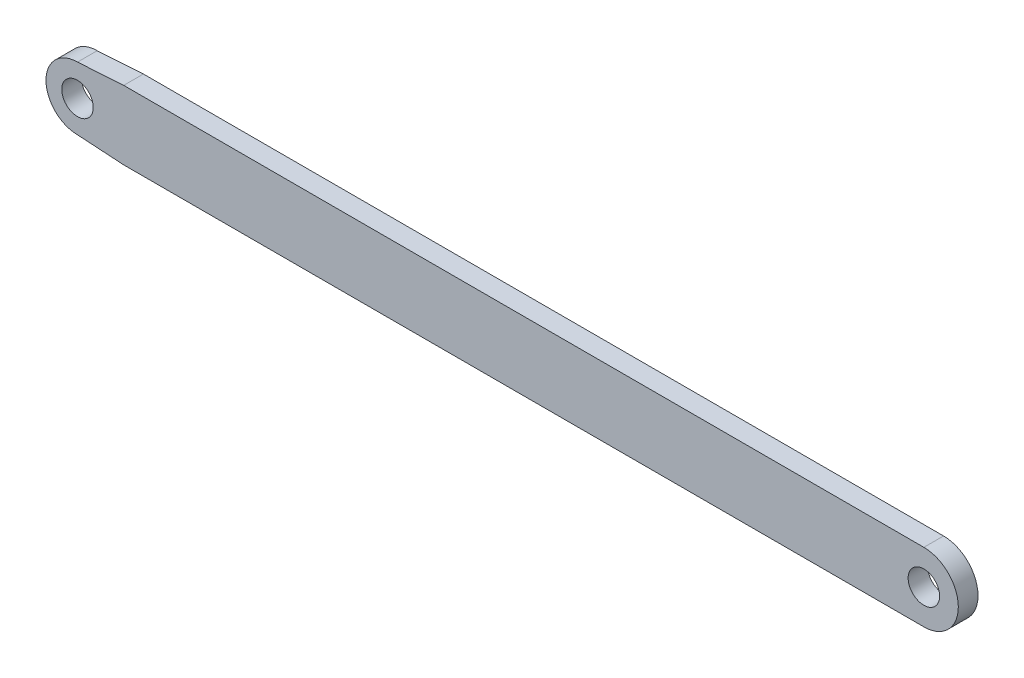
from build123d import *

# Parameters (mm, degrees)
SKETCH_3_R          = 8
EXTRUDE_1_DEPTH     = 5
SKETCH_4_R          = 4
CUT_EXTRUDE_1_DEPTH = 213.248558243


with BuildPart() as part:
    # 草图3 → 凸台-拉伸1 (new body)
    with BuildSketch(Plane.XY):
        with BuildLine():
            ThreePointArc((203.259167971, -8.750002099), (194.509167971, -2.099e-06), (203.259167971, 8.749997901))
            Line((203.259167971, 8.749997901), (0, 8.749997901))
            Line((0, 8.749997901), (-11.740832029, 8))
            ThreePointArc((-11.740832029, 8), (-6.08397778, 5.656854249), (-3.740832029, 0))
            ThreePointArc((-3.740832029, 0), (-6.08397778, -5.656854249), (-11.740832029, -8))
            Line((-11.740832029, -8), (0, -8.750038444))
            Line((0, -8.750038444), (203.259167971, -8.750002099))
        make_face()
        with Locations((-11.740832029, 0)):
            Circle(SKETCH_3_R)
        with BuildLine():
            ThreePointArc((212.009167971, -2.099e-06), (209.446352306, 6.187182236), (203.259167971, 8.749997901))
            Line((203.259167971, 8.749997901), (203.259167971, -8.750002099))
            ThreePointArc((203.259167971, -8.750002099), (209.446352306, -6.187186435), (212.009167971, -2.099e-06))
        make_face()
        with BuildLine():
            Line((203.259167971, -8.750002099), (203.259167971, 8.749997901))
            ThreePointArc((203.259167971, 8.749997901), (194.509167971, -2.099e-06), (203.259167971, -8.750002099))
        make_face()
    extrude(amount=EXTRUDE_1_DEPTH)

    # 草图4 → 切除-拉伸1 (cut, through all)
    with BuildSketch(Plane.XY.offset(5)):
        with Locations((-11.740832029, 0)):
            Circle(SKETCH_4_R)
        with Locations((203.259167971, -2.099e-06)):
            Circle(SKETCH_4_R)
    extrude(amount=-CUT_EXTRUDE_1_DEPTH, mode=Mode.SUBTRACT)


solid = part.part
